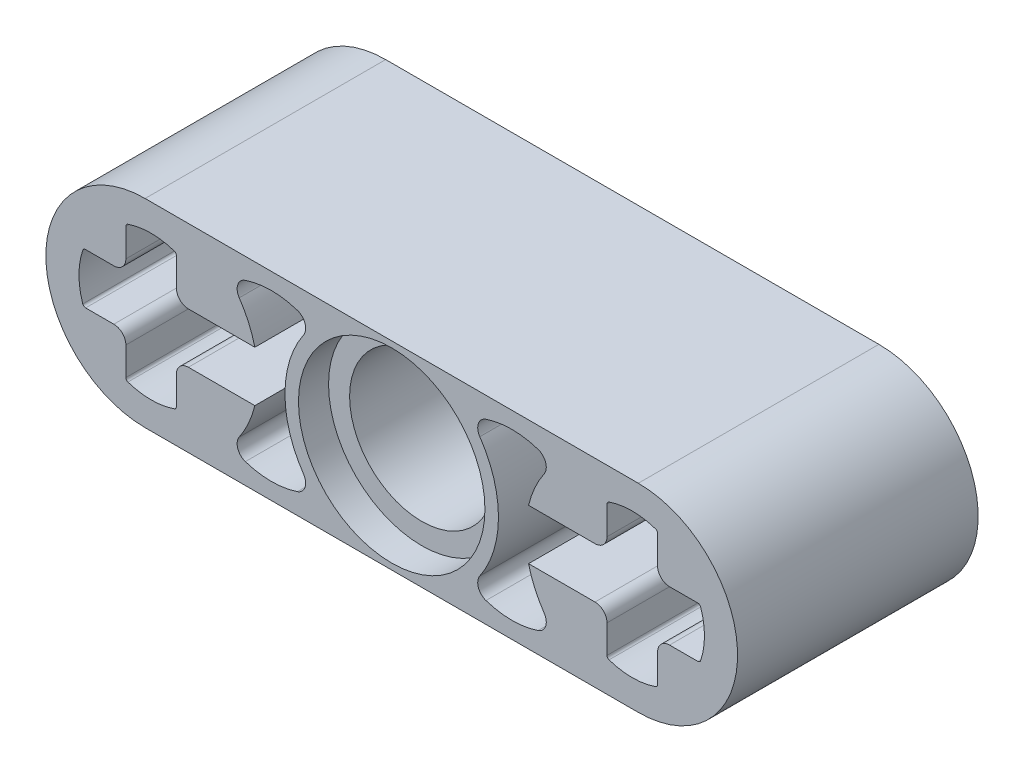
from build123d import *

# Parameters (mm, degrees)
SKETCH2_R           = 2.4
BOSS_EXTRUDE1_DEPTH = 4
SKETCH4_R           = 3.1
CUT_EXTRUDE1_DEPTH  = 1


with BuildPart() as part:
    # Sketch2 → Boss-Extrude1 (new, symmetric)
    with BuildSketch(Plane.XY):
        with BuildLine():
            Line((8.2, 3.3), (-8.2, 3.3))
            ThreePointArc((-8.2, 3.3), (-11.5, 0), (-8.2, -3.3))
            Line((-8.2, -3.3), (8.2, -3.3))
            ThreePointArc((8.2, -3.3), (11.5, 0), (8.2, 3.3))
        make_face()
        with BuildLine():
            Line((-10.177705214, 0.84), (-9.24, 0.84))
            ThreePointArc((-9.24, 0.84), (-8.957157288, 0.957157288), (-8.84, 1.24))
            Line((-8.84, 1.24), (-8.84, 2.177705214))
            ThreePointArc((-8.84, 2.177705214), (-8.821293884, 2.235940121), (-8.772173913, 2.27238805))
            ThreePointArc((-8.772173913, 2.27238805), (-8, 2.4), (-7.227826087, 2.27238805))
            ThreePointArc((-7.227826087, 2.27238805), (-7.178706116, 2.235940121), (-7.16, 2.177705214))
            Line((-7.16, 2.177705214), (-7.16, 1.24))
            ThreePointArc((-7.16, 1.24), (-7.042842712, 0.957157288), (-6.76, 0.84))
            Line((-6.76, 0.84), (-5.822294786, 0.84))
            Line((-5.822294786, 0.84), (-5.751800721, 0.84))
            Line((-5.751800721, 0.84), (-4.55081169, 0.84))
            ThreePointArc((-4.55081169, 0.84), (-4.757752494, 1.445797742), (-5.070126582, 2.004580194))
            ThreePointArc((-5.070126582, 2.004580194), (-5.119033599, 2.358251088), (-4.865957447, 2.610099174))
            ThreePointArc((-4.865957447, 2.610099174), (-4, 2.75), (-3.134042553, 2.610099174))
            ThreePointArc((-3.134042553, 2.610099174), (-2.880966401, 2.358251088), (-2.929873418, 2.004580194))
            ThreePointArc((-2.929873418, 2.004580194), (-3.55, 0), (-2.929873418, -2.004580194))
            ThreePointArc((-2.929873418, -2.004580194), (-2.880966401, -2.358251088), (-3.134042553, -2.610099174))
            ThreePointArc((-3.134042553, -2.610099174), (-4, -2.75), (-4.865957447, -2.610099174))
            ThreePointArc((-4.865957447, -2.610099174), (-5.119033599, -2.358251088), (-5.070126582, -2.004580194))
            ThreePointArc((-5.070126582, -2.004580194), (-4.757752494, -1.445797742), (-4.55081169, -0.84))
            Line((-4.55081169, -0.84), (-5.751800721, -0.84))
            Line((-5.751800721, -0.84), (-5.822294786, -0.84))
            Line((-5.822294786, -0.84), (-6.76, -0.84))
            ThreePointArc((-6.76, -0.84), (-7.042842712, -0.957157288), (-7.16, -1.24))
            Line((-7.16, -1.24), (-7.16, -2.177705214))
            ThreePointArc((-7.16, -2.177705214), (-7.178706116, -2.235940121), (-7.227826087, -2.27238805))
            ThreePointArc((-7.227826087, -2.27238805), (-8, -2.4), (-8.772173913, -2.27238805))
            ThreePointArc((-8.772173913, -2.27238805), (-8.821293884, -2.235940121), (-8.84, -2.177705214))
            Line((-8.84, -2.177705214), (-8.84, -1.24))
            ThreePointArc((-8.84, -1.24), (-8.957157288, -0.957157288), (-9.24, -0.84))
            Line((-9.24, -0.84), (-10.177705214, -0.84))
            ThreePointArc((-10.177705214, -0.84), (-10.235940121, -0.821293884), (-10.27238805, -0.772173913))
            ThreePointArc((-10.27238805, -0.772173913), (-10.4, 0), (-10.27238805, 0.772173913))
            ThreePointArc((-10.27238805, 0.772173913), (-10.235940121, 0.821293884), (-10.177705214, 0.84))
        make_face(mode=Mode.SUBTRACT)
        Circle(SKETCH2_R, mode=Mode.SUBTRACT)
        with BuildLine():
            Line((8.84, 2.177705214), (8.84, 1.24))
            ThreePointArc((8.84, 1.24), (8.957157288, 0.957157288), (9.24, 0.84))
            Line((9.24, 0.84), (10.177705214, 0.84))
            ThreePointArc((10.177705214, 0.84), (10.235940121, 0.821293884), (10.27238805, 0.772173913))
            ThreePointArc((10.27238805, 0.772173913), (10.4, 0), (10.27238805, -0.772173913))
            ThreePointArc((10.27238805, -0.772173913), (10.235940121, -0.821293884), (10.177705214, -0.84))
            Line((10.177705214, -0.84), (9.24, -0.84))
            ThreePointArc((9.24, -0.84), (8.957157288, -0.957157288), (8.84, -1.24))
            Line((8.84, -1.24), (8.84, -2.177705214))
            ThreePointArc((8.84, -2.177705214), (8.821293884, -2.235940121), (8.772173913, -2.27238805))
            ThreePointArc((8.772173913, -2.27238805), (8, -2.4), (7.227826087, -2.27238805))
            ThreePointArc((7.227826087, -2.27238805), (7.178706116, -2.235940121), (7.16, -2.177705214))
            Line((7.16, -2.177705214), (7.16, -1.24))
            ThreePointArc((7.16, -1.24), (7.042842712, -0.957157288), (6.76, -0.84))
            Line((6.76, -0.84), (5.822294786, -0.84))
            Line((5.822294786, -0.84), (5.751800721, -0.84))
            Line((5.751800721, -0.84), (4.55081169, -0.84))
            ThreePointArc((4.55081169, -0.84), (4.757752494, -1.445797742), (5.070126582, -2.004580194))
            ThreePointArc((5.070126582, -2.004580194), (5.119033599, -2.358251088), (4.865957447, -2.610099174))
            ThreePointArc((4.865957447, -2.610099174), (4, -2.75), (3.134042553, -2.610099174))
            ThreePointArc((3.134042553, -2.610099174), (2.880966401, -2.358251088), (2.929873418, -2.004580194))
            ThreePointArc((2.929873418, -2.004580194), (3.55, 0), (2.929873418, 2.004580194))
            ThreePointArc((2.929873418, 2.004580194), (2.880966401, 2.358251088), (3.134042553, 2.610099174))
            ThreePointArc((3.134042553, 2.610099174), (4, 2.75), (4.865957447, 2.610099174))
            ThreePointArc((4.865957447, 2.610099174), (5.119033599, 2.358251088), (5.070126582, 2.004580194))
            ThreePointArc((5.070126582, 2.004580194), (4.757752494, 1.445797742), (4.55081169, 0.84))
            Line((4.55081169, 0.84), (5.751800721, 0.84))
            Line((5.751800721, 0.84), (5.822294786, 0.84))
            Line((5.822294786, 0.84), (6.76, 0.84))
            ThreePointArc((6.76, 0.84), (7.042842712, 0.957157288), (7.16, 1.24))
            Line((7.16, 1.24), (7.16, 2.177705214))
            ThreePointArc((7.16, 2.177705214), (7.178706116, 2.235940121), (7.227826087, 2.27238805))
            ThreePointArc((7.227826087, 2.27238805), (8, 2.4), (8.772173913, 2.27238805))
            ThreePointArc((8.772173913, 2.27238805), (8.821293884, 2.235940121), (8.84, 2.177705214))
        make_face(mode=Mode.SUBTRACT)
    extrude(amount=BOSS_EXTRUDE1_DEPTH, both=True)

    # Sketch4 → Cut-Extrude1 (cut)
    with BuildSketch(Plane.XY.offset(4)):
        Circle(SKETCH4_R)
    cut_extrude1 = extrude(amount=-CUT_EXTRUDE1_DEPTH, mode=Mode.SUBTRACT)

    # Mirror1: Cut-Extrude1 across plane
    add(cut_extrude1.mirror(Plane.XY), mode=Mode.SUBTRACT)


solid = part.part
